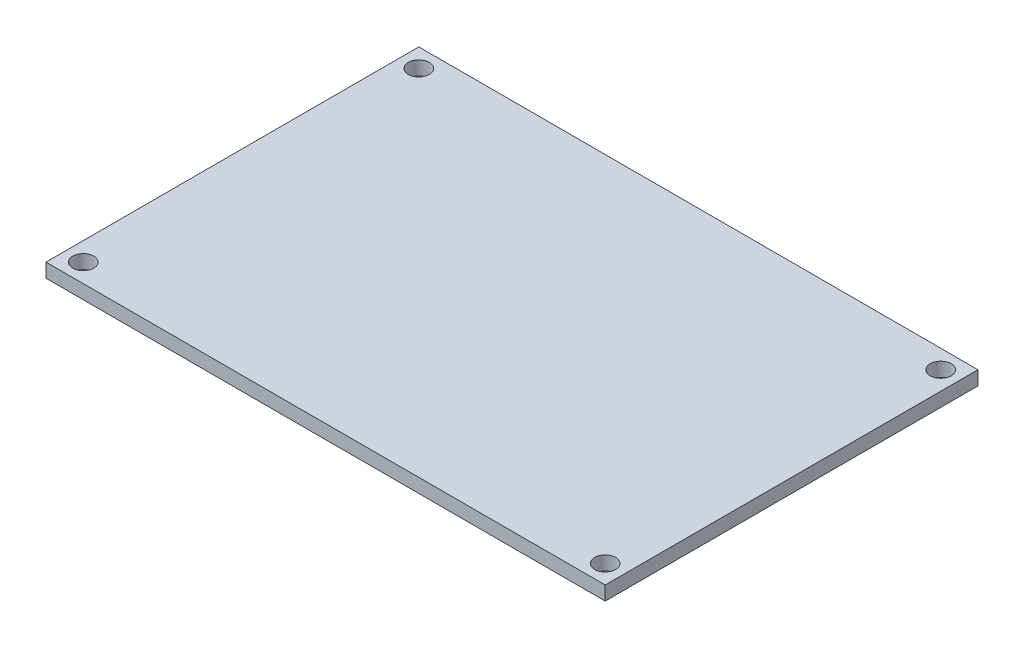
from build123d import *

# Parameters (mm, degrees)
SKETCH1_W           = 60
SKETCH1_H           = 40
SKETCH1_R           = 1.125
BOSS_EXTRUDE1_DEPTH = 1.5


with BuildPart() as part:
    # Sketch1 → Boss-Extrude1 (new body)
    with BuildSketch(Plane(origin=(0, 0, 0), x_dir=(1, 0, 0), z_dir=(0, 1, 0))):
        Rectangle(SKETCH1_W, SKETCH1_H)
        with Locations(Location((-28, 18, 0), (0, 0, 270))):
            Circle(SKETCH1_R, mode=Mode.SUBTRACT)
        with Locations(Location((28, 18, 0), (0, 0, 270))):
            Circle(SKETCH1_R, mode=Mode.SUBTRACT)
        with Locations(Location((28, -18, 0), (0, 0, 270))):
            Circle(SKETCH1_R, mode=Mode.SUBTRACT)
        with Locations(Location((-28, -18, 0), (0, 0, 270))):
            Circle(SKETCH1_R, mode=Mode.SUBTRACT)
    extrude(amount=BOSS_EXTRUDE1_DEPTH)


solid = part.part
